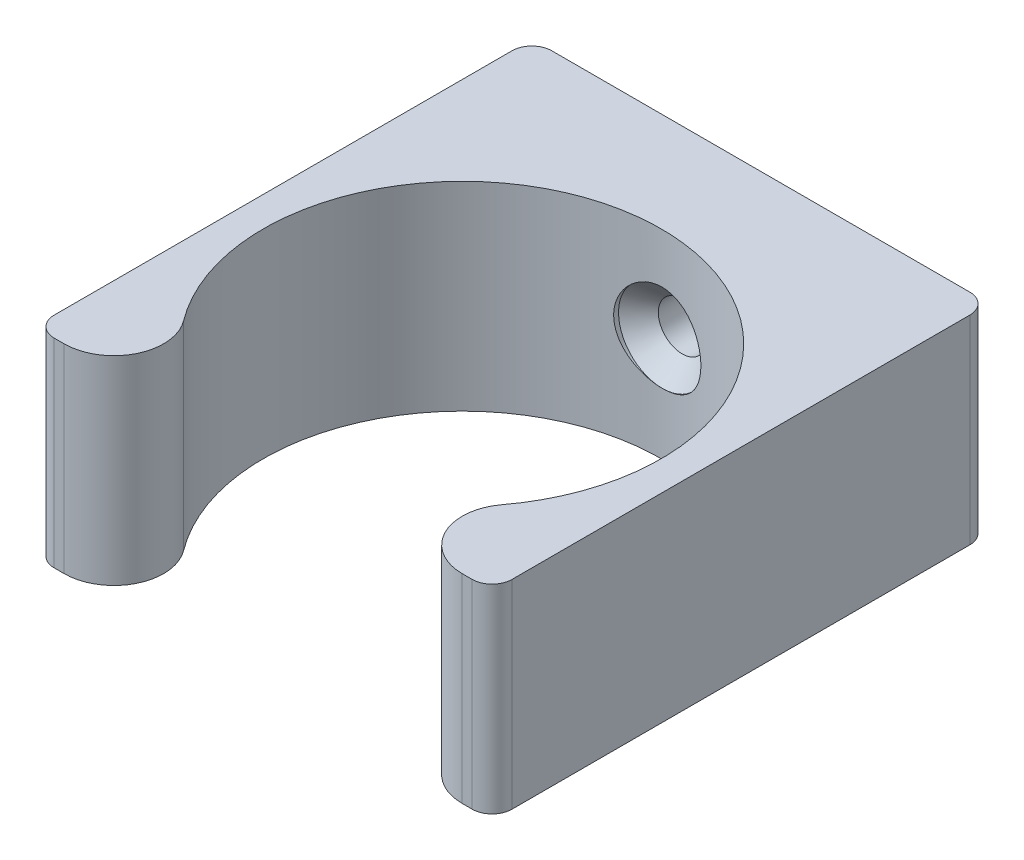
from build123d import *
from build123d.topology import SkipClean

# Parameters (mm, degrees)
BOSS_EXTRUDE1_DEPTH                             = 10
CSK_FOR_M2_FLAT_HEAD_MACHINE_SCREW1_D           = 2.4
CSK_FOR_M2_FLAT_HEAD_MACHINE_SCREW1_CSINK_D     = 4.4
CSK_FOR_M2_FLAT_HEAD_MACHINE_SCREW1_CSINK_ANGLE = 90


with BuildPart() as part:
    # Sketch1 → Boss-Extrude1 (new body)
    with BuildSketch(Plane(origin=(0, 0, 0), x_dir=(1, 0, 0), z_dir=(0, 1, 0))):
        with BuildLine():
            Line((-10.5, -12.5), (-10, -12.5))
            ThreePointArc((-10, -12.5), (-7.763932, -11.118034), (-8, -8.5))
            ThreePointArc((-8, -8.5), (0.019966, 7.49998), (7.975978, -8.531897))
            ThreePointArc((7.975978, -8.531897), (7.772753, -11.135807), (10, -12.5))
            Line((10, -12.5), (10.5, -12.5))
            ThreePointArc((10.5, -12.5), (11.207107, -12.207107), (11.5, -11.5))
            Line((11.5, -11.5), (11.5, 11.5))
            ThreePointArc((11.5, 11.5), (11.207107, 12.207107), (10.5, 12.5))
            Line((10.5, 12.5), (-10.5, 12.5))
            ThreePointArc((-10.5, 12.5), (-11.207107, 12.207107), (-11.5, 11.5))
            Line((-11.5, 11.5), (-11.5, -11.5))
            ThreePointArc((-11.5, -11.5), (-11.207107, -12.207107), (-10.5, -12.5))
        make_face()
    extrude(amount=BOSS_EXTRUDE1_DEPTH)

    # CSK for M2 Flat Head Machine Screw1 (through all)
    with Locations(Plane(origin=(0.042886, 5.285729, -7.499908), x_dir=(0.999990804037, 0, 0.004288571028), z_dir=(-0.004288571028, 0, 0.999990804037))):
        with Locations((0, 0)):
            CounterSinkHole(CSK_FOR_M2_FLAT_HEAD_MACHINE_SCREW1_D / 2, CSK_FOR_M2_FLAT_HEAD_MACHINE_SCREW1_CSINK_D / 2, counter_sink_angle=CSK_FOR_M2_FLAT_HEAD_MACHINE_SCREW1_CSINK_ANGLE)


solid = part.part
